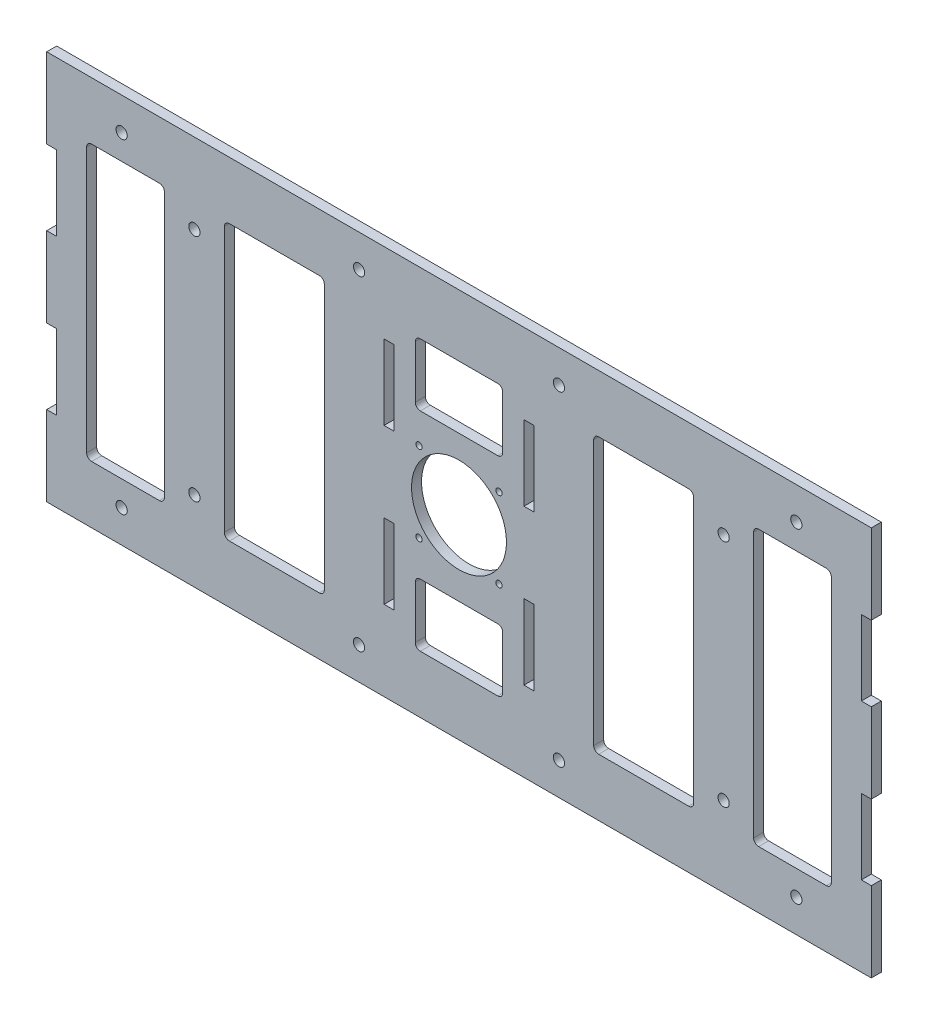
from build123d import *

# Parameters (mm, degrees)
SKIZZE1_W                       = 330
SKIZZE1_H                       = 156
AUFSATZ_LINEAR_AUSTRAGEN1_DEPTH = 4
SKIZZE2_R                       = 2.25
SKIZZE2_W                       = 31.1
SKIZZE2_H                       = 110
SCHNITT_LINEAR_AUSTRAGEN1_DEPTH = 183.551362635
M3_GEWINDEBOHRUNG1_D            = 2.5
SKIZZE5_R                       = 19
SCHNITT_LINEAR_AUSTRAGEN2_DEPTH = 183.551362635
SKIZZE7_W                       = 35
SKIZZE7_H                       = 25
SCHNITT_LINEAR_AUSTRAGEN3_DEPTH = 183.551362635
VERRUNDUNG1_R                   = 2
SCHNITT_LINEAR_AUSTRAGEN4_DEPTH = 183.551362635
SKIZZE9_W                       = 4
SKIZZE9_H                       = 30
SCHNITT_LINEAR_AUSTRAGEN5_DEPTH = 183.551362635


with BuildPart() as part:
    # Skizze1 → Aufsatz-Linear austragen1 (new body)
    with BuildSketch(Plane.XY):
        Rectangle(SKIZZE1_W, SKIZZE1_H)
    extrude(amount=AUFSATZ_LINEAR_AUSTRAGEN1_DEPTH)

    # Skizze2 → Schnitt-Linear austragen1 (cut, through all)
    with BuildSketch(Plane.XY.offset(4)):
        with Locations((-105.9, 46)):
            Circle(SKIZZE2_R)
        with Locations((-105.9, -46)):
            Circle(SKIZZE2_R)
        with Locations((105.9, -46)):
            Circle(SKIZZE2_R)
        with Locations((105.9, 46)):
            Circle(SKIZZE2_R)
        with Locations((-40, 65)):
            Circle(SKIZZE2_R)
        with Locations((40, 65)):
            Circle(SKIZZE2_R)
        with Locations((-40, -65)):
            Circle(SKIZZE2_R)
        with Locations((40, -65)):
            Circle(SKIZZE2_R)
        with Locations((-135, -65)):
            Circle(SKIZZE2_R)
        with Locations((-135, 65)):
            Circle(SKIZZE2_R)
        with Locations(Location((135, -65, 0), (0, 0, 180))):
            Circle(SKIZZE2_R)
        with Locations(Location((135, 65, 0), (0, 0, 180))):
            Circle(SKIZZE2_R)
        with Locations((133.45, 0)):
            Rectangle(SKIZZE2_W, SKIZZE2_H)
        with Locations((-133.45, 0)):
            Rectangle(SKIZZE2_W, SKIZZE2_H)
    extrude(amount=-SCHNITT_LINEAR_AUSTRAGEN1_DEPTH, mode=Mode.SUBTRACT)

    # M3 Gewindebohrung1 (through all)
    with Locations(Plane.XY.offset(4)):
        with Locations((16, -16), (0, 0), (16, 16), (-16, -16), (-16, 16)):
            Hole(M3_GEWINDEBOHRUNG1_D / 2)

    # Skizze5 → Schnitt-Linear austragen2 (cut, through all)
    with BuildSketch(Plane.XY.offset(4)):
        Circle(SKIZZE5_R)
    extrude(amount=-SCHNITT_LINEAR_AUSTRAGEN2_DEPTH, mode=Mode.SUBTRACT)

    # Skizze7 → Schnitt-Linear austragen3 (cut, through all)
    with BuildSketch(Plane.XY.offset(4)):
        with Locations((0, -42.5)):
            Rectangle(SKIZZE7_W, SKIZZE7_H)
        with Locations((0, 40.787318201)):
            Rectangle(SKIZZE7_W, SKIZZE7_H)
    extrude(amount=-SCHNITT_LINEAR_AUSTRAGEN3_DEPTH, mode=Mode.SUBTRACT)

    # Verrundung1
    verrundung1_edges = [part.edges().sort_by_distance(p)[0] for p in [
        (-17.5, 28.287318201, 2),
        (-17.5, 53.287318201, 2),
        (17.5, 53.287318201, 2),
        (17.5, 28.287318201, 2),
        (17.5, -30, 2),
        (17.5, -55, 2),
        (-17.5, -55, 2),
        (-17.5, -30, 2),
        (149, 55, 2),
        (149, -55, 2),
        (117.9, -55, 2),
        (117.9, 55, 2),
        (-149, -55, 2),
        (-149, 55, 2),
        (-117.9, 55, 2),
        (-117.9, -55, 2),
    ]]
    fillet(verrundung1_edges, radius=VERRUNDUNG1_R)

    # Skizze8 → Schnitt-Linear austragen4 (cut, through all)
    with BuildSketch(Plane.XY.offset(4)):
        with BuildLine():
            Line((-93.9, 9), (-93.9, -9))
            Line((-93.9, -9), (-93.9, -53))
            ThreePointArc((-93.9, -53), (-93.314213562, -54.414213562), (-91.9, -55))
            Line((-91.9, -55), (-55.9, -55))
            ThreePointArc((-55.9, -55), (-54.485786438, -54.414213562), (-53.9, -53))
            Line((-53.9, -53), (-53.9, -9))
            Line((-53.9, -9), (-53.9, 9))
            Line((-53.9, 9), (-53.9, 53))
            ThreePointArc((-53.9, 53), (-54.485786438, 54.414213562), (-55.9, 55))
            Line((-55.9, 55), (-91.9, 55))
            ThreePointArc((-91.9, 55), (-93.314213562, 54.414213562), (-93.9, 53))
            Line((-93.9, 53), (-93.9, 9))
        make_face()
        with BuildLine():
            Line((53.9, 9), (53.9, 53))
            ThreePointArc((53.9, 53), (54.485786438, 54.414213562), (55.9, 55))
            Line((55.9, 55), (91.9, 55))
            ThreePointArc((91.9, 55), (93.314213562, 54.414213562), (93.9, 53))
            Line((93.9, 53), (93.9, 9))
            Line((93.9, 9), (93.9, -9))
            Line((93.9, -9), (93.9, -53))
            ThreePointArc((93.9, -53), (93.314213562, -54.414213562), (91.9, -55))
            Line((91.9, -55), (55.9, -55))
            ThreePointArc((55.9, -55), (54.485786438, -54.414213562), (53.9, -53))
            Line((53.9, -53), (53.9, -9))
            Line((53.9, -9), (53.9, 9))
        make_face()
    extrude(amount=-SCHNITT_LINEAR_AUSTRAGEN4_DEPTH, mode=Mode.SUBTRACT)

    # Skizze9 → Schnitt-Linear austragen5 (cut, through all)
    with BuildSketch(Plane.XY.offset(4)):
        with Locations((-163, 31)):
            Rectangle(SKIZZE9_W, SKIZZE9_H)
        with Locations((-163, -31)):
            Rectangle(SKIZZE9_W, SKIZZE9_H)
        with Locations((163, -31)):
            Rectangle(SKIZZE9_W, SKIZZE9_H)
        with Locations((163, 31)):
            Rectangle(SKIZZE9_W, SKIZZE9_H)
        with Locations((-28, -31)):
            Rectangle(SKIZZE9_W, SKIZZE9_H)
        with Locations((-28, 31)):
            Rectangle(SKIZZE9_W, SKIZZE9_H)
        with Locations((28, -31)):
            Rectangle(SKIZZE9_W, SKIZZE9_H)
        with Locations((28, 31)):
            Rectangle(SKIZZE9_W, SKIZZE9_H)
    extrude(amount=-SCHNITT_LINEAR_AUSTRAGEN5_DEPTH, mode=Mode.SUBTRACT)


solid = part.part
